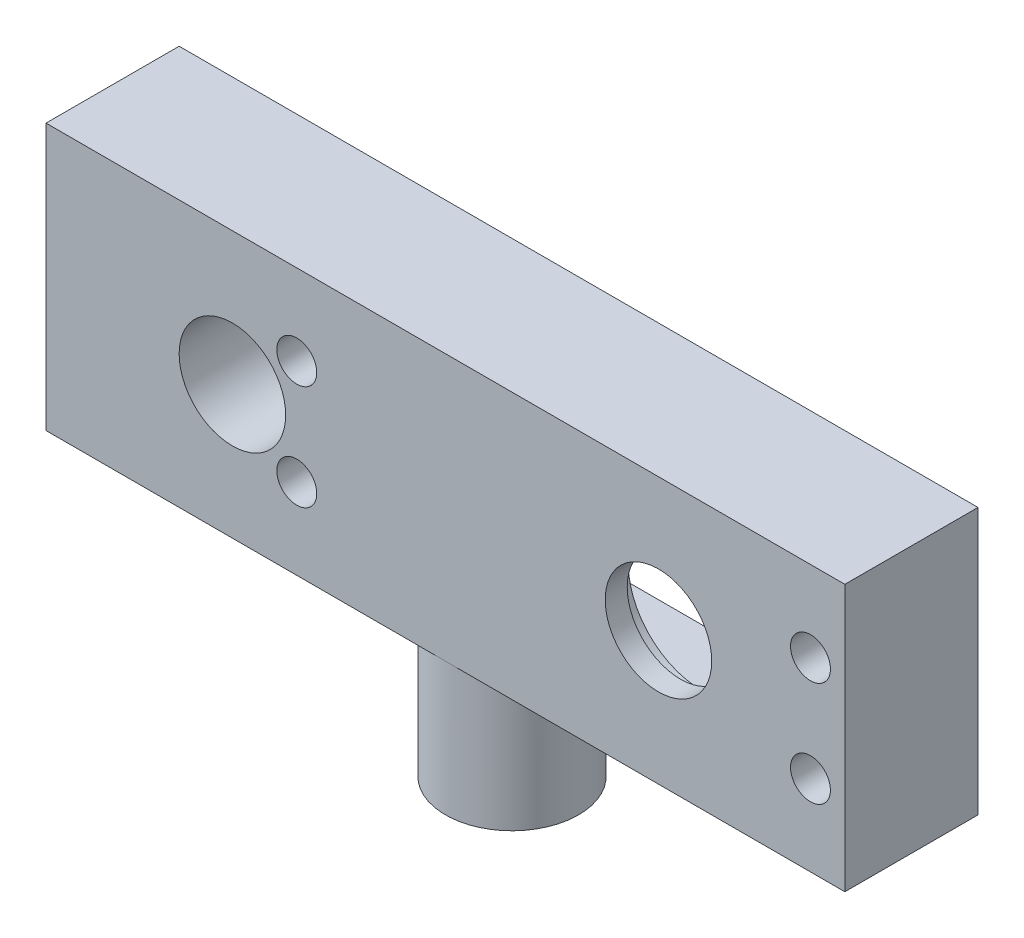
from build123d import *

# Parameters (mm, degrees)
SKETCH1_W           = 76.2
SKETCH1_H           = 25.4
BOSS_EXTRUDE1_DEPTH = 12.7
SKETCH2_R           = 5.08
CUT_EXTRUDE1_DEPTH  = 43.121134838
SKETCH3_R           = 1.905
CUT_EXTRUDE2_DEPTH  = 43.121134838
SKETCH4_W           = 40.64
SKETCH4_H           = 20.32
SKETCH4_W_2         = 5.703951
SKETCH4_H_2         = 2.54
CUT_EXTRUDE3_DEPTH  = 8.599932
SKETCH5_R           = 6.985
CUT_EXTRUDE4_DEPTH  = 1.999996
SKETCH9_R           = 6.35
BOSS_EXTRUDE3_DEPTH = 12.7
SKETCH7_R           = 3.175
CUT_EXTRUDE5_DEPTH  = 12.7


with BuildPart() as part:
    # Sketch1 → Boss-Extrude1 (new body)
    with BuildSketch(Plane.XY):
        Rectangle(SKETCH1_W, SKETCH1_H)
    extrude(amount=BOSS_EXTRUDE1_DEPTH)

    # Sketch2 → Cut-Extrude1 (cut, through all)
    with BuildSketch(Plane.XY.offset(12.7)):
        with Locations((20.32, 0)):
            Circle(SKETCH2_R)
        with Locations(Location((-20.32, 0, 0), (0, 0, 180))):
            Circle(SKETCH2_R)
    extrude(amount=-CUT_EXTRUDE1_DEPTH, mode=Mode.SUBTRACT)

    # Sketch3 → Cut-Extrude2 (cut, through all)
    with BuildSketch(Plane.XY.offset(12.7)):
        with Locations((34.820098, 4.99999)):
            Circle(SKETCH3_R)
        with Locations((-14.179804, 4.99999)):
            Circle(SKETCH3_R)
        with Locations(Location((34.820098, -4.99999, 0), (0, 0, 180))):
            Circle(SKETCH3_R)
        with Locations(Location((-14.179804, -4.99999, 0), (0, 0, 180))):
            Circle(SKETCH3_R)
    extrude(amount=-CUT_EXTRUDE2_DEPTH, mode=Mode.SUBTRACT)

    # Sketch4 → Cut-Extrude3 (cut)
    with BuildSketch(Plane(origin=(0, 0, 0), x_dir=(-1, 0, 0), z_dir=(0, 0, -1))):
        with Locations((-10.320147, 0)):
            Rectangle(SKETCH4_W, SKETCH4_H)
        with Locations((-33.4921225, 0)):
            Rectangle(SKETCH4_W_2, SKETCH4_H_2)
        with Locations((12.8518285, 0)):
            Rectangle(SKETCH4_W_2, SKETCH4_H_2)
    extrude(amount=-CUT_EXTRUDE3_DEPTH, mode=Mode.SUBTRACT)

    # Sketch5 → Cut-Extrude4 (cut)
    with BuildSketch(Plane(origin=(0, 0, 8.599932), x_dir=(-1, 0, 0), z_dir=(0, 0, -1))):
        with Locations((-20.32, 0)):
            Circle(SKETCH5_R)
    extrude(amount=-CUT_EXTRUDE4_DEPTH, mode=Mode.SUBTRACT)

    # Sketch9 → Boss-Extrude3 (add)
    with BuildSketch(Plane.XZ.offset(12.7)):
        with Locations(Location((0, 6.35, 0), (0, 0, 270))):
            Circle(SKETCH9_R)
    extrude(amount=BOSS_EXTRUDE3_DEPTH)

    # Sketch7 → Cut-Extrude5 (cut)
    with BuildSketch(Plane.XZ.offset(25.4)):
        with Locations(Location((0, 6.35, 0), (0, 0, 270))):
            Circle(SKETCH7_R)
    extrude(amount=-CUT_EXTRUDE5_DEPTH, mode=Mode.SUBTRACT)


solid = part.part
